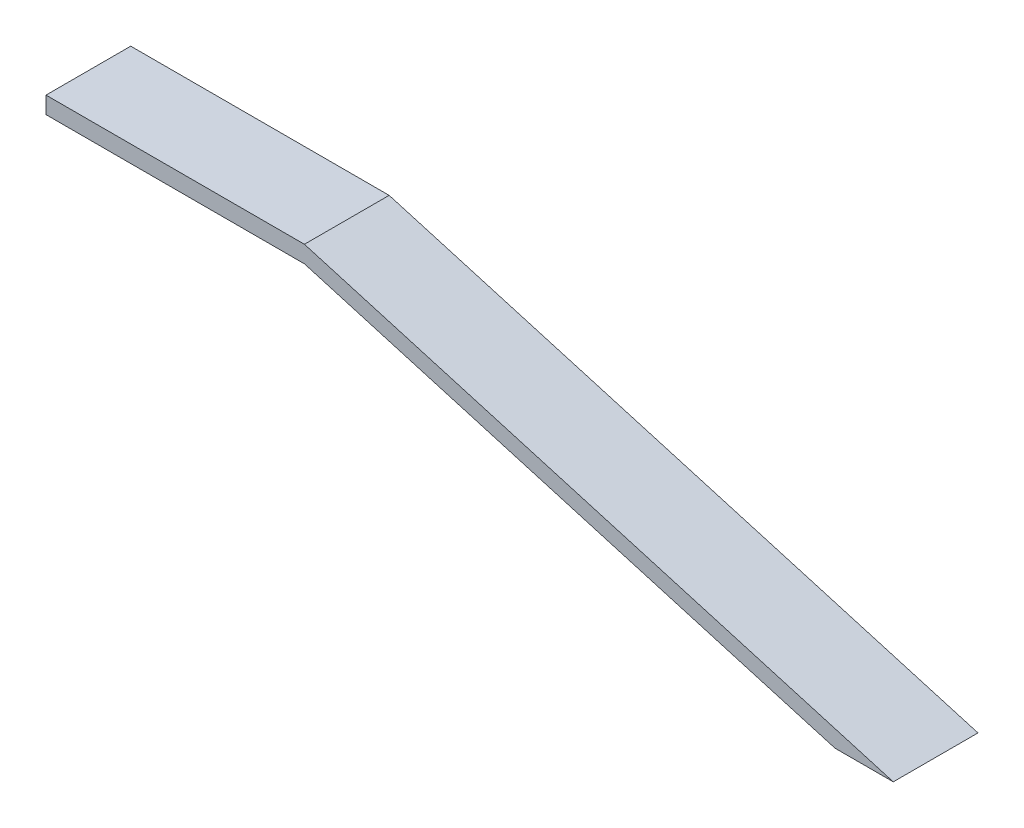
from build123d import *

# Parameters (mm, degrees)
SKETCH1_W           = 254
SKETCH1_H           = 177.8
BOSS_EXTRUDE1_DEPTH = 25.4
CUT_EXTRUDE1_DEPTH  = 158.090324336


with BuildPart() as part:
    # Sketch1 → Boss-Extrude1 (new body)
    with BuildSketch(Plane.XY):
        Rectangle(SKETCH1_W, SKETCH1_H)
    extrude(amount=BOSS_EXTRUDE1_DEPTH)

    # Sketch3 → Cut-Extrude1 (cut, through all)
    with BuildSketch(Plane.XY.offset(25.4)):
        Polygon((127, 88.9), (-49.53, 88.9), (127, 37.598007728), align=None)
        Polygon((-49.53, 83.82), (-127, 83.82), (-127, -88.9), (127, -88.9), (127, 37.598007728), (109.519735389, 37.598007728), align=None)
    extrude(amount=-CUT_EXTRUDE1_DEPTH, mode=Mode.SUBTRACT)


solid = part.part
